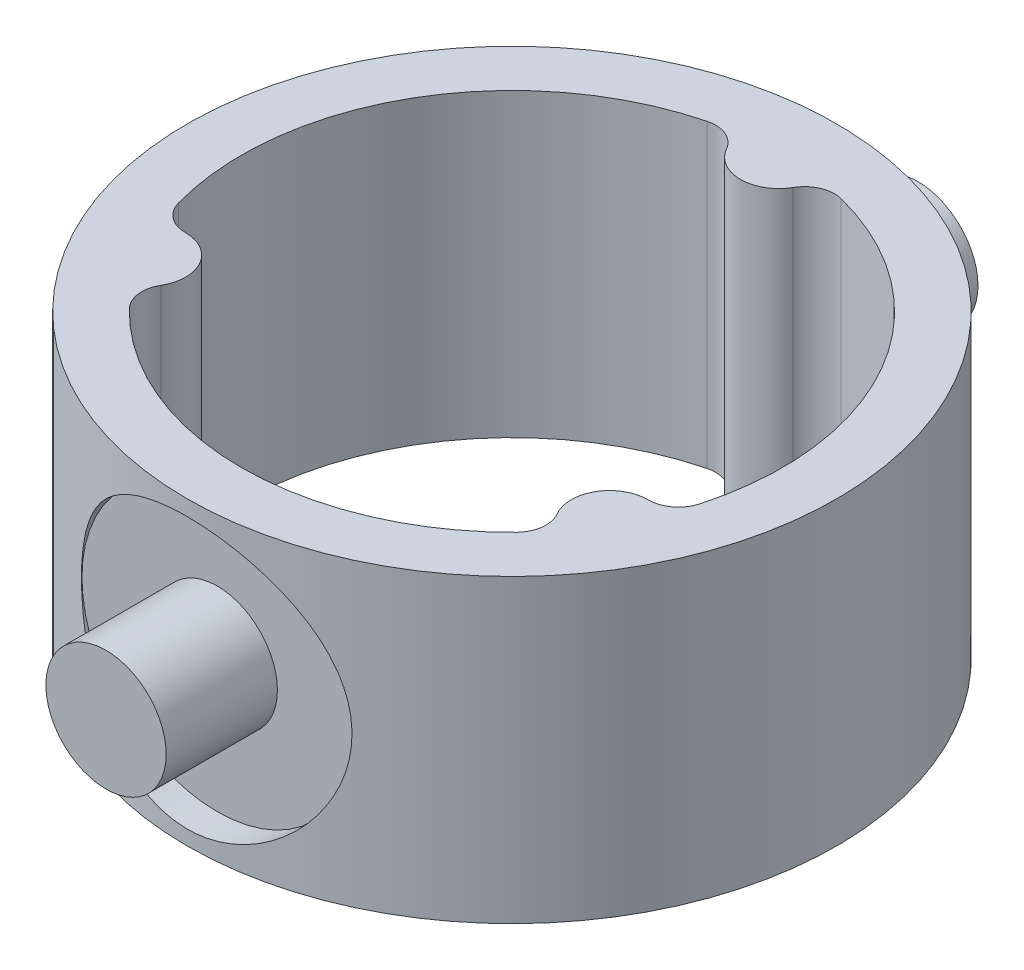
from build123d import *

# Parameters (mm, degrees)
BOSS_EXTRUDE1_DEPTH      = 7.5
BOSS_EXTRUDE1_DEPTH_BACK = 2.5
SKETCH1_R                = 10.8
SKETCH1_R_2              = 7.6
BOSS_EXTRUDE2_DEPTH      = 13.5
BOSS_EXTRUDE2_DEPTH_BACK = 13.5
SKETCH2_R                = 2
SKETCH3_R                = 7.25
CUT_EXTRUDE1_DEPTH       = 14
SKETCH4_R                = 7
CUT_EXTRUDE2_DEPTH       = 10
FILLET2_R                = 1
CUT_EXTRUDE3_START       = -9.8
SKETCH5_R                = 4.5
SKETCH5_R_2              = 2
CUT_EXTRUDE3_DEPTH       = 9.5
CUT_EXTRUDE4_START       = 19.3
SKETCH6_R                = 4.5
SKETCH6_R_2              = 2
CUT_EXTRUDE4_DEPTH       = 9.5


with BuildPart() as part:
    # Sketch1 → Boss-Extrude1 (new, two sides: drawn at the far end of the back side and taken through both)
    with BuildSketch(Plane(origin=(0, 0, 0), x_dir=(1, 0, 0), z_dir=(0, 1, 0)).offset(-BOSS_EXTRUDE1_DEPTH_BACK)):
        with Locations(Location((0, 0, 0), (0, 0, 270))):
            Circle(SKETCH1_R)
        with Locations(Location((0, 0, 0), (0, 0, 270))):
            Circle(SKETCH1_R_2, mode=Mode.SUBTRACT)
    extrude(amount=BOSS_EXTRUDE1_DEPTH + BOSS_EXTRUDE1_DEPTH_BACK)

    # Sketch2 → Boss-Extrude2 (add, two sides: drawn at the far end of the back side and taken through both)
    with BuildSketch(Plane.XY.offset(-BOSS_EXTRUDE2_DEPTH_BACK)):
        with Locations((0, 2.488781623)):
            Circle(SKETCH2_R)
    extrude(amount=BOSS_EXTRUDE2_DEPTH + BOSS_EXTRUDE2_DEPTH_BACK)

    # Sketch3 → Cut-Extrude1 (cut)
    with BuildSketch(Plane(origin=(0, 7.5, 0), x_dir=(1, 0, 0), z_dir=(0, 1, 0))):
        Circle(SKETCH3_R)
    extrude(amount=-CUT_EXTRUDE1_DEPTH, mode=Mode.SUBTRACT)

    # Sketch4 → Cut-Extrude2 (cut)
    with BuildSketch(Plane(origin=(0, 7.5, 0), x_dir=(1, 0, 0), z_dir=(0, 1, 0))):
        with BuildLine():
            ThreePointArc((-1.274588785, 8.908659182), (0, 7.6), (1.274588785, 8.908659182))
            ThreePointArc((1.274588785, 8.908659182), (7.793689033, 4.499688461), (8.352419558, -3.350503324))
            ThreePointArc((8.352419558, -3.350503324), (6.581793069, -3.8), (7.077830773, -5.558155858))
            ThreePointArc((7.077830773, -5.558155858), (0, -8.999376922), (-7.077830773, -5.558155858))
            ThreePointArc((-7.077830773, -5.558155858), (-6.581793069, -3.8), (-8.352419558, -3.350503324))
            ThreePointArc((-8.352419558, -3.350503324), (-7.793689033, 4.499688461), (-1.274588785, 8.908659182))
        make_face()
        Circle(SKETCH4_R, mode=Mode.SUBTRACT)
    extrude(amount=-CUT_EXTRUDE2_DEPTH, mode=Mode.SUBTRACT)

    # Fillet2
    fillet2_edges = [part.edges().sort_by_distance(p)[0] for p in [
        (-8.352419558, 2.5, 3.350503324),
        (-1.274588785, 2.5, -8.908659182),
        (1.274588785, 2.5, -8.908659182),
        (8.352419558, 2.5, 3.350503324),
        (7.077830773, 2.5, 5.558155858),
        (-7.077830773, 2.5, 5.558155858),
    ]]
    fillet(fillet2_edges, radius=FILLET2_R)

    # Sketch5 → Cut-Extrude3 (cut)
    with BuildSketch(Plane.XY.offset(CUT_EXTRUDE3_START)):
        with Locations((0, 2.488781623)):
            Circle(SKETCH5_R)
        with Locations((0, 2.488781623)):
            Circle(SKETCH5_R_2, mode=Mode.SUBTRACT)
    extrude(amount=-CUT_EXTRUDE3_DEPTH, mode=Mode.SUBTRACT)

    # Sketch6 → Cut-Extrude4 (cut)
    with BuildSketch(Plane.XY.offset(CUT_EXTRUDE4_START)):
        with Locations((0, 2.488781623)):
            Circle(SKETCH6_R)
        with Locations((0, 2.488781623)):
            Circle(SKETCH6_R_2, mode=Mode.SUBTRACT)
    extrude(amount=-CUT_EXTRUDE4_DEPTH, mode=Mode.SUBTRACT)


solid = part.part
